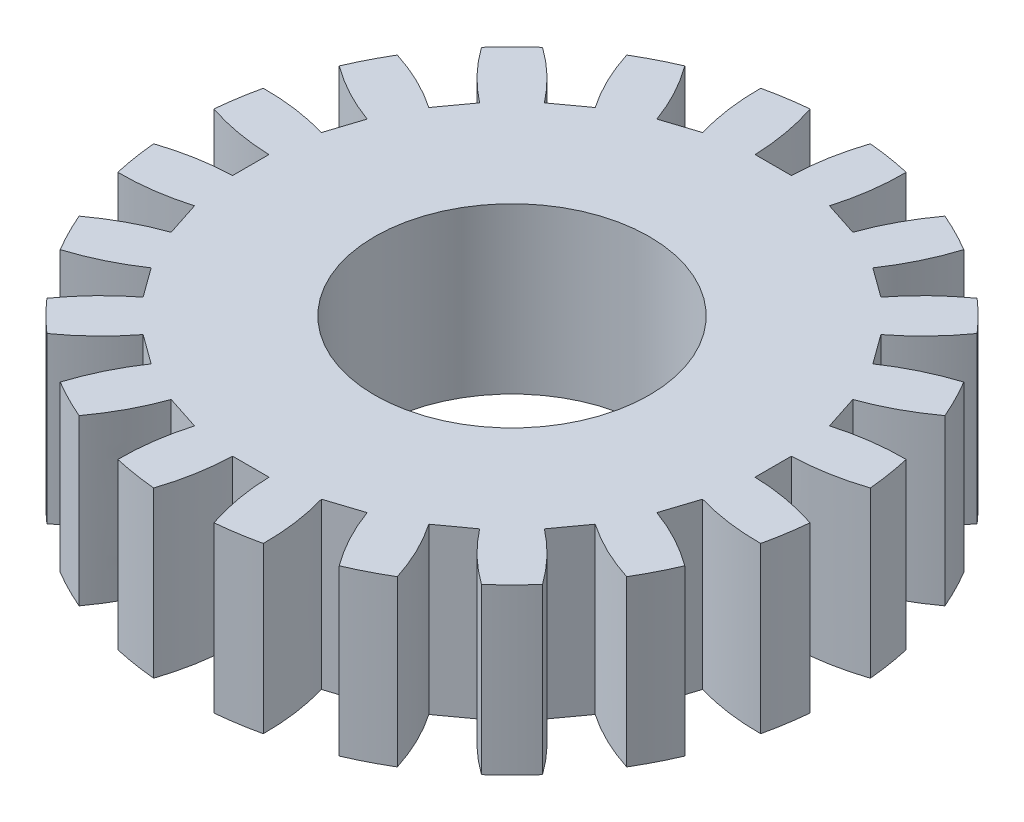
from build123d import *

# Parameters (mm, degrees)
SKETCH_1_R               = 60
SKETCH_1_R_2             = 25
EXTRUDE_1_DEPTH          = 30
CUT_EXTRUDE_START        = -30
CUT_EXTRUDE_2_DEPTH      = 121
PATTERN_CIRCULAR_2_COUNT = 20


with BuildPart() as part:
    # 草图1 → 凸台-拉伸1 (new body)
    with BuildSketch(Plane(origin=(0, 0, 0), x_dir=(1, 0, 0), z_dir=(0, 1, 0))):
        with Locations(Location((0, 0, 0), (0, 0, 270))):
            Circle(SKETCH_1_R)
        with Locations(Location((0, 0, 0), (0, 0, 270))):
            Circle(SKETCH_1_R_2, mode=Mode.SUBTRACT)
    extrude(amount=EXTRUDE_1_DEPTH)

    # 草图4 → 切除-拉伸2 (cut)
    with BuildSketch(Plane(origin=(0, 30, 0), x_dir=(1, 0, 0), z_dir=(0, 1, 0)).offset(CUT_EXTRUDE_START)):
        with BuildLine():
            add(Edge.make_bspline(
                [(-5.484590944, 59.748801345), (-3.507129286, 53.800069089), (-3.308044881, 47.553145162)],
                knots=[0, 0, 0, 1, 1, 1], degree=2))
            Line((-3.308044881, 47.553145162), (3.308044881, 47.553145162))
            add(Edge.make_bspline(
                [(5.484590944, 59.748801345), (3.507129286, 53.800069089), (3.308044881, 47.553145162)],
                knots=[0, 0, 0, 1, 1, 1], degree=2))
            ThreePointArc((5.484590944, 59.748801345), (0, 60), (-5.484590944, 59.748801345))
        make_face()
    cut_extrude_2 = extrude(amount=CUT_EXTRUDE_2_DEPTH, mode=Mode.SUBTRACT)

    # 阵列(圆周)2: 切除-拉伸2 ×20 about axis
    pattern_circular_2_axis = Axis((0, 55.707747744, 0), (0, -1, 0))
    for i in range(1, PATTERN_CIRCULAR_2_COUNT):
        add(cut_extrude_2.rotate(pattern_circular_2_axis, i * 360 / PATTERN_CIRCULAR_2_COUNT), mode=Mode.SUBTRACT)


solid = part.part
